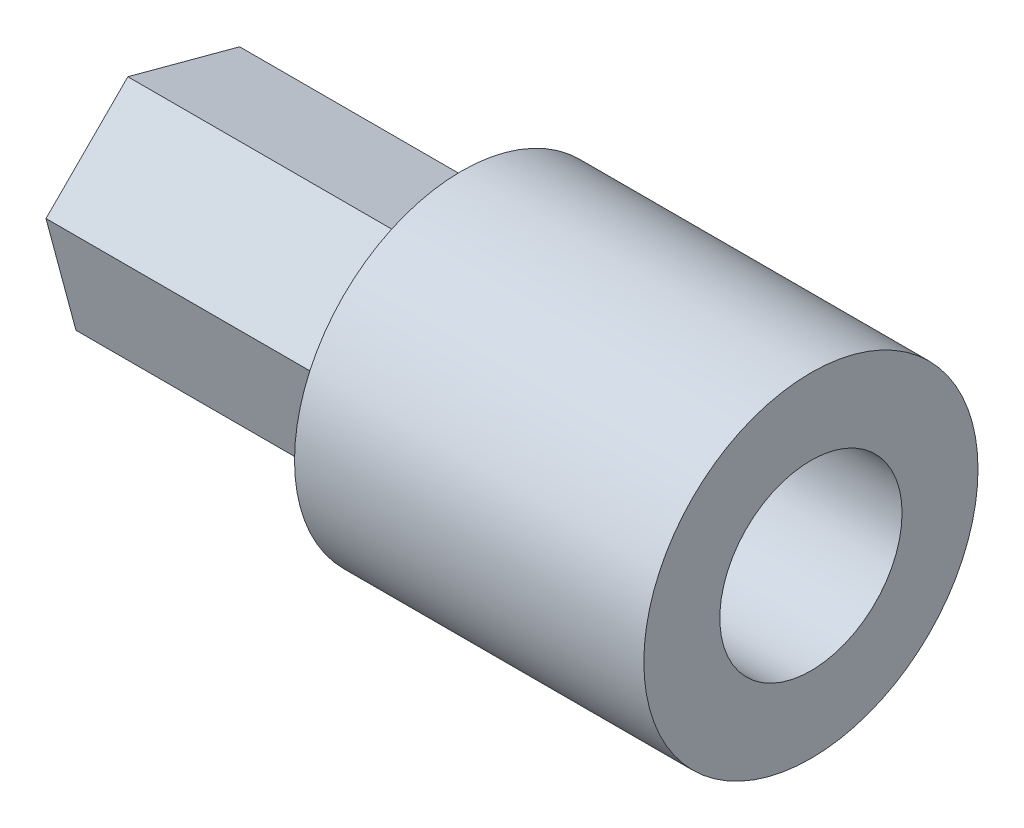
from build123d import *

# Parameters (mm, degrees)
EXTRUDE_1_DEPTH     = 10
SKETCH_2_3_R        = 1.5
CUT_EXTRUDE_1_DEPTH = 4.5
SKETCH_3_R          = 5.5
EXTRUDE_2_DEPTH     = 11.5
SKETCH_4_R          = 3
CUT_EXTRUDE_2_DEPTH = 9.5


with BuildPart() as part:
    # 草图2 → 凸台-拉伸1 (new body)
    with BuildSketch(Plane(origin=(0, 0, 0), x_dir=(0, 0, -1), z_dir=(1, 0, 0))):
        Polygon((3.680671736, -0.986233019), (2.694438717, 2.694438717), (-0.986233019, 3.680671736), (-3.680671736, 0.986233019), (-2.694438717, -2.694438717), (0.986233019, -3.680671736), align=None)
    extrude(amount=EXTRUDE_1_DEPTH)

    # 草图2<3> → 切除-拉伸1 (cut)
    with BuildSketch(Plane(origin=(0, 0, 0), x_dir=(0, 0, -1), z_dir=(1, 0, 0))):
        Circle(SKETCH_2_3_R)
    extrude(amount=CUT_EXTRUDE_1_DEPTH, mode=Mode.SUBTRACT)

    # 草图3 → 凸台-拉伸2 (add)
    with BuildSketch(Plane(origin=(10, 0, 0), x_dir=(0, 0, -1), z_dir=(1, 0, 0))):
        Circle(SKETCH_3_R)
    extrude(amount=EXTRUDE_2_DEPTH)

    # 草图4 → 切除-拉伸2 (cut)
    with BuildSketch(Plane(origin=(21.5, 0, 0), x_dir=(0, 0, -1), z_dir=(1, 0, 0))):
        Circle(SKETCH_4_R)
    extrude(amount=-CUT_EXTRUDE_2_DEPTH, mode=Mode.SUBTRACT)


solid = part.part
